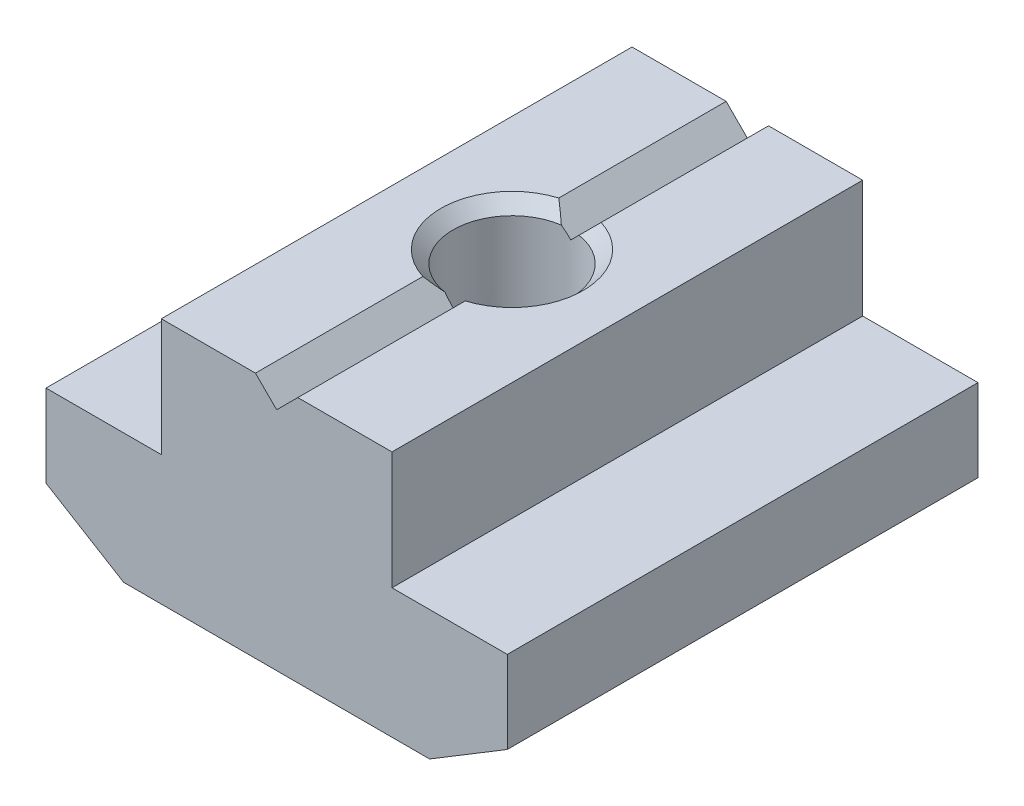
from build123d import *

# Parameters (mm, degrees)
BOSS_EXTRUDE1_DEPTH             = 20
CUT_EXTRUDE1_DEPTH              = 45
M6X1_0_TAPPED_HOLE1_D           = 5
M6X1_0_TAPPED_HOLE1_DEPTH       = 15
M6X1_0_TAPPED_HOLE1_CSINK_D     = 6.05
M6X1_0_TAPPED_HOLE1_CSINK_ANGLE = 90
M6X1_0_TAPPED_HOLE1_TIP         = 1.502151548


with BuildPart() as part:
    # Sketch1 → Boss-Extrude1 (new body)
    with BuildSketch(Plane.XY):
        Polygon((6.5, 0), (-6.5, 0), (-9.8, 2), (-9.8, 5.5), (-4.9, 5.5), (-4.9, 10.5), (4.9, 10.5), (4.9, 5.5), (9.8, 5.5), (9.8, 2), align=None)
    extrude(amount=-BOSS_EXTRUDE1_DEPTH)

    # Sketch2 → Cut-Extrude1 (cut)
    with BuildSketch(Plane.XY):
        Polygon((-0.9, 10.5), (0, 9.6), (0.9, 10.5), align=None)
    extrude(amount=-CUT_EXTRUDE1_DEPTH, mode=Mode.SUBTRACT)

    # M6x1.0 Tapped Hole1
    with Locations(Plane(origin=(0, 10.5, 0), x_dir=(1, 0, 0), z_dir=(0, 1, 0))):
        with Locations((0, 10)):
            CounterSinkHole(M6X1_0_TAPPED_HOLE1_D / 2, M6X1_0_TAPPED_HOLE1_CSINK_D / 2, depth=M6X1_0_TAPPED_HOLE1_DEPTH, counter_sink_angle=M6X1_0_TAPPED_HOLE1_CSINK_ANGLE)
            with Locations((0, 0, -(M6X1_0_TAPPED_HOLE1_DEPTH + M6X1_0_TAPPED_HOLE1_TIP / 2))):  # 118° drill point
                Cone(0, M6X1_0_TAPPED_HOLE1_D / 2, M6X1_0_TAPPED_HOLE1_TIP, mode=Mode.SUBTRACT)


solid = part.part
